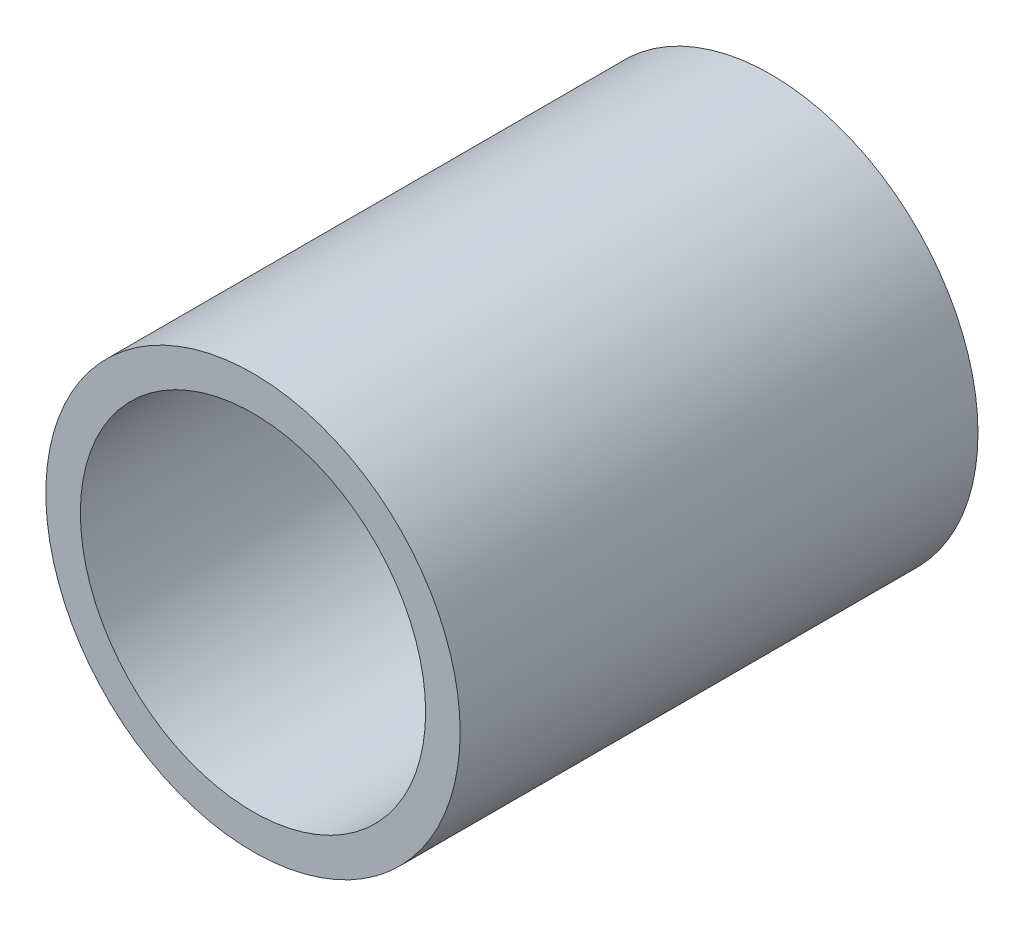
from build123d import *

# Parameters (mm, degrees)
ESBO_O1_R                = 6
ESBO_O1_R_2              = 5
RESSALTO_EXTRUS_O1_DEPTH = 15


with BuildPart() as part:
    # Esboço1 → Ressalto-extrusão1 (new body)
    with BuildSketch(Plane.XY):
        Circle(ESBO_O1_R)
        Circle(ESBO_O1_R_2, mode=Mode.SUBTRACT)
    extrude(amount=RESSALTO_EXTRUS_O1_DEPTH)


solid = part.part
